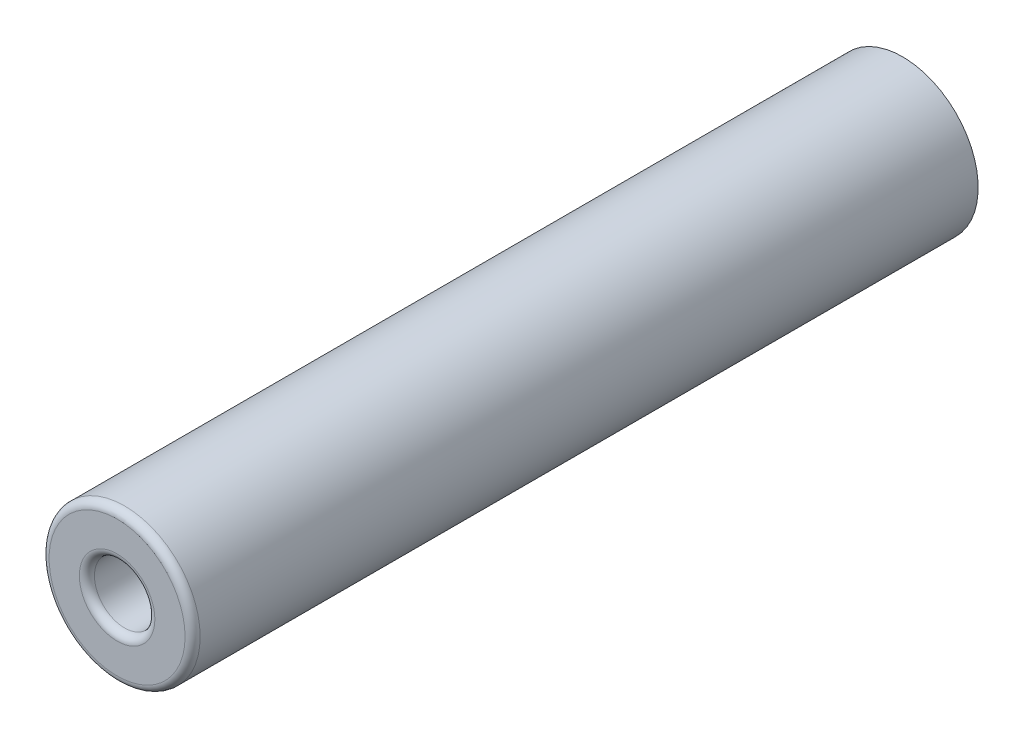
from build123d import *

# Parameters (mm, degrees)
CROQUIS1_R              = 2.5
SALIENTE_EXTRUIR1_DEPTH = 26
CROQUIS2_R              = 1
CORTAR_EXTRUIR1_DEPTH   = 10
REDONDEO1_R             = 0.25


with BuildPart() as part:
    # Croquis1 → Saliente-Extruir1 (new body)
    with BuildSketch(Plane.XY):
        with Locations(Location((0, 0, 0), (0, 0, 180))):
            Circle(CROQUIS1_R)
    extrude(amount=SALIENTE_EXTRUIR1_DEPTH)

    # Croquis2 → Cortar-Extruir1 (cut)
    with BuildSketch(Plane.XY.offset(26)):
        Circle(CROQUIS2_R)
    extrude(amount=-CORTAR_EXTRUIR1_DEPTH, mode=Mode.SUBTRACT)

    # Redondeo1
    redondeo1_edges = [part.edges().sort_by_distance(p)[0] for p in [
        (2.5, 0, 26),
        (-1, 0, 26),
    ]]
    fillet(redondeo1_edges, radius=REDONDEO1_R)


solid = part.part
